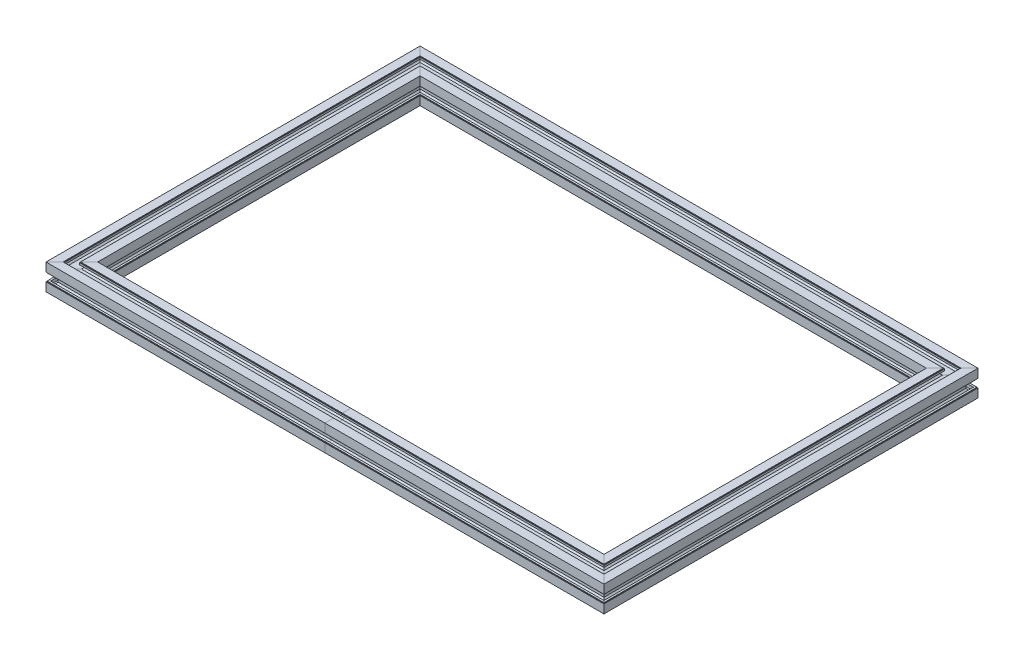
from build123d import *

# Parameters (mm, degrees)
CROQUIS2_R = 2.5


with BuildPart() as part:
    # Barrer1: sweep along a path in Croquis1
    with BuildLine(Plane(origin=(0, 0, 0), x_dir=(1, 0, 0), z_dir=(0, 1, 0))) as barrer1_path:
        Line((-200.934, 131.5), (200.934, 131.5))
        Line((200.934, 131.5), (200.934, -131.5))
        Line((200.934, -131.5), (-200.934, -131.5))
        Line((-200.934, -131.5), (-200.934, 131.5))
    # Croquis2 → Barrer1 (sweep)
    with BuildSketch(Plane(origin=(0, 0, 0), x_dir=(0, 0, -1), z_dir=(1, 0, 0))):
        Polygon((-134.849716447, 9.750635048), (-134.849716447, 9.390635048), (-134.344716447, 9.390635048), (-134.344716447, 8.020635048), (-136.679716447, 8.020635048), (-136.679716447, 6.720635048), (-135.123236313, 5.163216334), (-127.876765738, 5.163216334), (-126.320285605, 6.720635048), (-126.320285605, 8.020635048), (-128.655285605, 8.020635048), (-128.655285605, 9.390635048), (-128.150285605, 9.390635048), (-128.150285605, 9.750635048), (-121.749166204, 9.750635048), (-121.749166204, 3.185392978), (-122.109166138, 3.185175958), (-122.108861707, 2.680176049), (-123.478861458, 2.679350168), (-123.480269074, 5.014349744), (-124.780268838, 5.01356606), (-126.336748971, 3.456147346), (-126.336748971, -3.456060512), (-124.780268838, -5.013479227), (-123.480269074, -5.01426291), (-123.478861458, -2.679263334), (-122.108861707, -2.680089216), (-122.109166138, -3.185089124), (-121.749166204, -3.185306144), (-121.749166204, -9.750548215), (-128.150285605, -9.750548215), (-128.150285605, -9.390548215), (-128.655285605, -9.390548215), (-128.655285605, -8.020548215), (-126.320285605, -8.020548215), (-126.320285605, -6.720548215), (-127.876765738, -5.1631295), (-135.123236313, -5.1631295), (-136.679716447, -6.720548215), (-136.679716447, -8.020548215), (-134.344716447, -8.020548215), (-134.344716447, -9.390548215), (-134.849716447, -9.390548215), (-134.849716447, -9.750548215), (-141.250835848, -9.750548215), (-141.250835848, -3.185306144), (-140.890835913, -3.185089124), (-140.891140344, -2.680089216), (-139.521140593, -2.679263334), (-139.519732977, -5.01426291), (-138.219733214, -5.013479227), (-136.66325308, -3.456060512), (-136.66325308, 3.456147346), (-138.219733214, 5.01356606), (-139.519732977, 5.014349744), (-139.521140593, 2.679350168), (-140.891140344, 2.680176049), (-140.890835913, 3.185175958), (-141.250835848, 3.185392978), (-141.250835848, 9.750635048), align=None)
        with Locations((-131.500001026, 4.3417e-05)):
            Circle(CROQUIS2_R, mode=Mode.SUBTRACT)
    sweep(path=barrer1_path.line, transition=Transition.RIGHT)


solid = part.part
